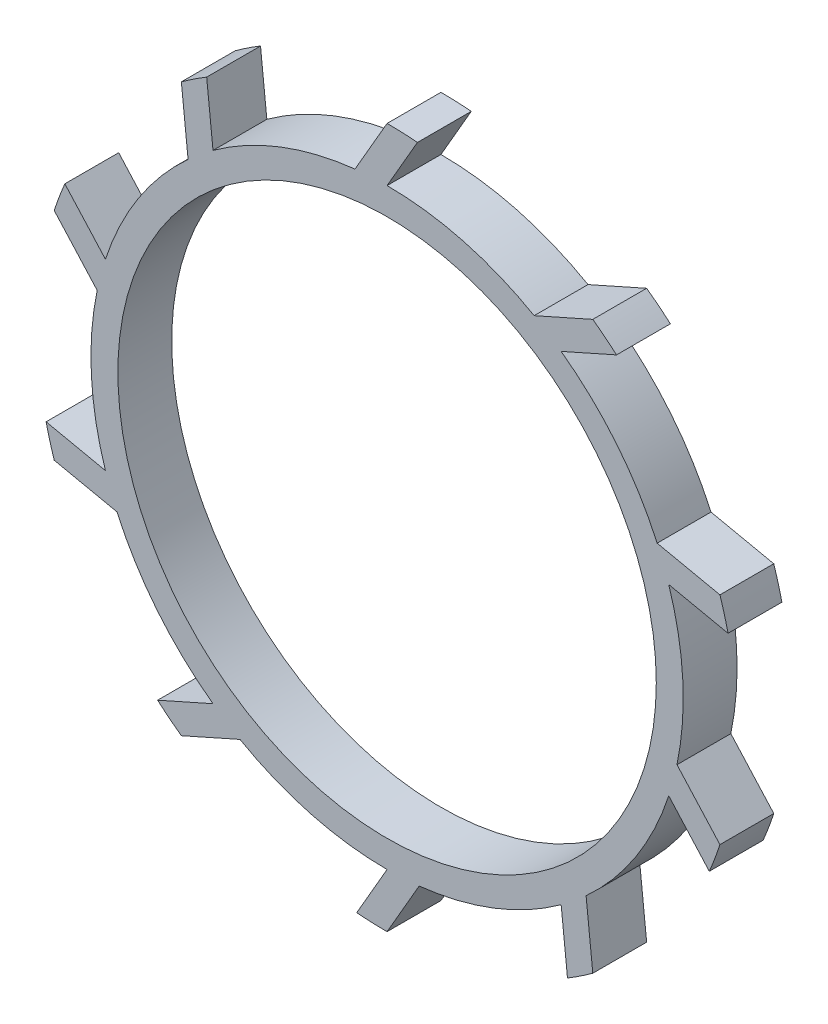
from build123d import *

# Parameters (mm, degrees)
SKETCH1_R           = 25
BOSS_EXTRUDE1_DEPTH = 2.5
SCALE1_SCALE        = 1.5


with BuildPart() as part:
    # Sketch1 → Boss-Extrude1 (new, symmetric)
    with BuildSketch(Plane.XY):
        with BuildLine():
            Line((0, 32.5), (-2.980263218, 27.338032686))
            ThreePointArc((-2.980263218, 27.338032686), (-9.904736181, 25.654360276), (-16.164094438, 22.247967345))
            Line((-16.164094438, 22.247967345), (-16.75283521, 27.849461618))
            ThreePointArc((-16.75283521, 27.849461618), (-17.944809925, 27.096748823), (-19.1030207, 26.293052317))
            Line((-19.1030207, 26.293052317), (-18.479976031, 20.365178268))
            ThreePointArc((-18.479976031, 20.365178268), (-23.092354522, 14.932955588), (-26.154054198, 8.497967345))
            Line((-26.154054198, 8.497967345), (-29.922831212, 12.683618263))
            ThreePointArc((-29.922831212, 12.683618263), (-30.444725533, 11.374035661), (-30.90933678, 10.043052317))
            Line((-30.90933678, 10.043052317), (-26.920966111, 5.613517939))
            ThreePointArc((-26.920966111, 5.613517939), (-27.459478317, -1.492330582), (-26.154054198, -8.497967345))
            Line((-26.154054198, -8.497967345), (-31.663322731, -7.326936169))
            ThreePointArc((-31.663322731, -7.326936169), (-31.315790766, -8.693172534), (-30.90933678, -10.043052317))
            Line((-30.90933678, -10.043052317), (-25.079062147, -11.282315447))
            ThreePointArc((-25.079062147, -11.282315447), (-21.338014708, -17.347597192), (-16.164094438, -22.247967345))
            Line((-16.164094438, -22.247967345), (-21.309501164, -24.538850017))
            ThreePointArc((-21.309501164, -24.538850017), (-20.225288311, -25.439884291), (-19.1030207, -26.293052317))
            Line((-19.1030207, -26.293052317), (-13.657808848, -23.868687803))
            ThreePointArc((-13.657808848, -23.868687803), (-7.066154732, -26.576671298), (0, -27.5))
            Line((0, -27.5), (-2.816174435, -32.377757204))
            ThreePointArc((-2.816174435, -32.377757204), (-1.409413153, -32.469424919), (0, -32.5))
            Line((0, -32.5), (2.980263218, -27.338032686))
            ThreePointArc((2.980263218, -27.338032686), (9.904736181, -25.654360276), (16.164094438, -22.247967345))
            Line((16.164094438, -22.247967345), (16.75283521, -27.849461618))
            ThreePointArc((16.75283521, -27.849461618), (17.944809925, -27.096748823), (19.1030207, -26.293052317))
            Line((19.1030207, -26.293052317), (18.479976031, -20.365178268))
            ThreePointArc((18.479976031, -20.365178268), (23.092354522, -14.932955588), (26.154054198, -8.497967345))
            Line((26.154054198, -8.497967345), (29.922831212, -12.683618263))
            ThreePointArc((29.922831212, -12.683618263), (30.444725533, -11.374035661), (30.90933678, -10.043052317))
            Line((30.90933678, -10.043052317), (26.920966111, -5.613517939))
            ThreePointArc((26.920966111, -5.613517939), (27.459478317, 1.492330582), (26.154054198, 8.497967345))
            Line((26.154054198, 8.497967345), (31.663322731, 7.326936169))
            ThreePointArc((31.663322731, 7.326936169), (31.315790766, 8.693172534), (30.90933678, 10.043052317))
            Line((30.90933678, 10.043052317), (25.079062147, 11.282315447))
            ThreePointArc((25.079062147, 11.282315447), (21.338014708, 17.347597192), (16.164094438, 22.247967345))
            Line((16.164094438, 22.247967345), (21.309501164, 24.538850017))
            ThreePointArc((21.309501164, 24.538850017), (20.225288311, 25.439884291), (19.1030207, 26.293052317))
            Line((19.1030207, 26.293052317), (13.657808848, 23.868687803))
            ThreePointArc((13.657808848, 23.868687803), (7.066154732, 26.576671298), (0, 27.5))
            Line((0, 27.5), (2.816174435, 32.377757204))
            ThreePointArc((2.816174435, 32.377757204), (1.409413153, 32.469424919), (0, 32.5))
        make_face()
        Circle(SKETCH1_R, mode=Mode.SUBTRACT)
    extrude(amount=BOSS_EXTRUDE1_DEPTH, both=True)


with BuildPart() as part_1:
    # Scale1: scaled about (0, 0, 0)
    add(part.part.scale(SCALE1_SCALE))


solid = part_1.part
